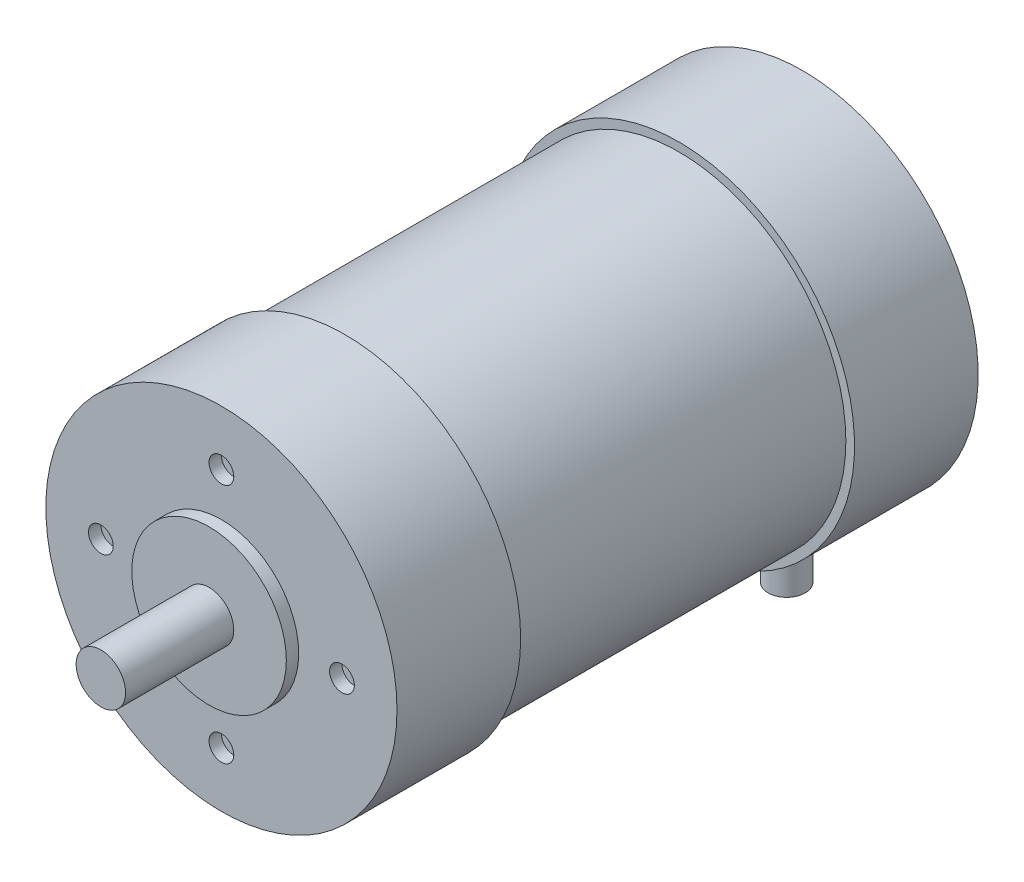
from build123d import *

# Parameters (mm, degrees)
SKETCH_1_R          = 27
EXTRUDE_1_DEPTH     = 94
SKETCH_2_R          = 28.4
SKETCH_2_R_2        = 27
EXTRUDE_2_DEPTH     = 20
EXTRUDE_START       = -20
SKETCH_3_R          = 28.4
SKETCH_3_R_2        = 27
EXTRUDE_3_DEPTH     = 20
SKETCH_5_R          = 3
EXTRUDE_4_DEPTH     = 15
SKETCH_9_R          = 4
EXTRUDE_6_DEPTH     = 19.5
SKETCH_10_R         = 12.5
SKETCH_10_R_2       = 4
EXTRUDE_7_DEPTH     = 2
SKETCH_11_R         = 2
CUT_EXTRUDE_2_DEPTH = 2


with BuildPart() as part:
    # 草图1 → 凸台-拉伸1 (new body)
    with BuildSketch(Plane.XY):
        Circle(SKETCH_1_R)
    extrude(amount=-EXTRUDE_1_DEPTH)

    # 草图2 → 凸台-拉伸2 (add)
    with BuildSketch(Plane.XY):
        Circle(SKETCH_2_R)
        Circle(SKETCH_2_R_2, mode=Mode.SUBTRACT)
    extrude(amount=-EXTRUDE_2_DEPTH)

    # 草图3 → 凸台-拉伸3 (add)
    with BuildSketch(Plane(origin=(0, 0, -94), x_dir=(-1, 0, 0), z_dir=(0, 0, -1)).offset(EXTRUDE_START)):
        with Locations(Location((0, 0, 0), (0, 0, 180))):
            Circle(SKETCH_3_R)
        with Locations(Location((0, 0, 0), (0, 0, 180))):
            Circle(SKETCH_3_R_2, mode=Mode.SUBTRACT)
    extrude(amount=EXTRUDE_3_DEPTH)

    # 草图5 → 凸台-拉伸4 (add)
    with BuildSketch(Plane(origin=(0, -20, 0), x_dir=(1, 0, 0), z_dir=(0, 1, 0))):
        with Locations(Location((-7, 84.431486428, 0), (0, 0, 270))):
            Circle(SKETCH_5_R)
        with Locations(Location((7, 84.431486428, 0), (0, 0, 270))):
            Circle(SKETCH_5_R)
    extrude(amount=-EXTRUDE_4_DEPTH)

    # 草图9 → 凸台-拉伸6 (add)
    with BuildSketch(Plane.XY):
        Circle(SKETCH_9_R)
    extrude(amount=EXTRUDE_6_DEPTH)

    # 草图10 → 凸台-拉伸7 (add)
    with BuildSketch(Plane.XY):
        Circle(SKETCH_10_R)
        Circle(SKETCH_10_R_2, mode=Mode.SUBTRACT)
    extrude(amount=EXTRUDE_7_DEPTH)

    # 草图11 → 切除-拉伸2 (cut)
    with BuildSketch(Plane.XY):
        with Locations((19.5, 0)):
            Circle(SKETCH_11_R)
        with Locations((0, 19.5)):
            Circle(SKETCH_11_R)
        with Locations((-19.5, 0)):
            Circle(SKETCH_11_R)
        with Locations((0, -19.5)):
            Circle(SKETCH_11_R)
    extrude(amount=-CUT_EXTRUDE_2_DEPTH, mode=Mode.SUBTRACT)


solid = part.part
